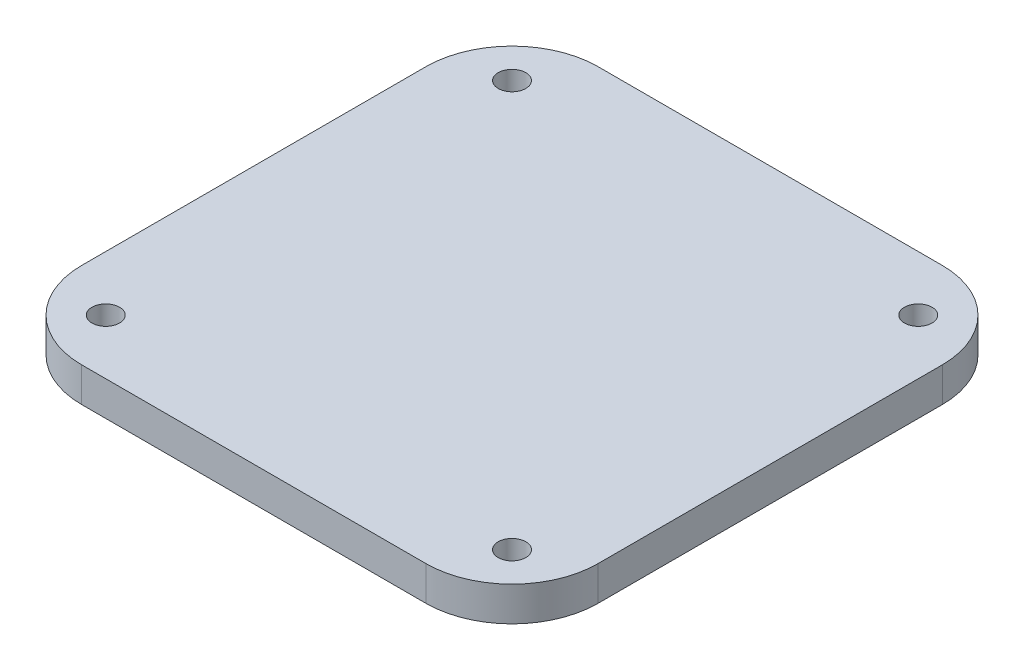
from build123d import *

# Parameters (mm, degrees)
SKETCH1_W           = 38.1
SKETCH1_H           = 38.1
SKETCH1_R           = 1.016
BOSS_EXTRUDE1_DEPTH = 2.54
FILLET1_R           = 6.35
FILLET2_R           = 0.5


with BuildPart() as part:
    # Sketch1 → Boss-Extrude1 (new body)
    with BuildSketch(Plane(origin=(0, 0, 0), x_dir=(1, 0, 0), z_dir=(0, 1, 0))):
        Rectangle(SKETCH1_W, SKETCH1_H)
        with Locations(Location((-14.986, 14.986, 0), (0, 0, 270))):
            Circle(SKETCH1_R, mode=Mode.SUBTRACT)
        with Locations(Location((-14.986, -14.986, 0), (0, 0, 270))):
            Circle(SKETCH1_R, mode=Mode.SUBTRACT)
        with Locations(Location((14.986, -14.986, 0), (0, 0, 270))):
            Circle(SKETCH1_R, mode=Mode.SUBTRACT)
        with Locations(Location((14.986, 14.986, 0), (0, 0, 270))):
            Circle(SKETCH1_R, mode=Mode.SUBTRACT)
    extrude(amount=BOSS_EXTRUDE1_DEPTH)

    # Fillet1
    fillet1_edges = [part.edges().sort_by_distance(p)[0] for p in [
        (-19.05, 1.27, -19.05),
        (19.05, 1.27, -19.05),
        (19.05, 1.27, 19.05),
        (-19.05, 1.27, 19.05),
    ]]
    fillet(fillet1_edges, radius=FILLET1_R)

    # Fillet2
    fillet2_edges = [part.edges().sort_by_distance(p)[0] for p in [
        (-14.986, 0, -16.002),
        (-14.986, 0, 13.97),
        (14.986, 0, 13.97),
        (14.986, 0, -16.002),
    ]]
    fillet(fillet2_edges, radius=FILLET2_R)


solid = part.part
